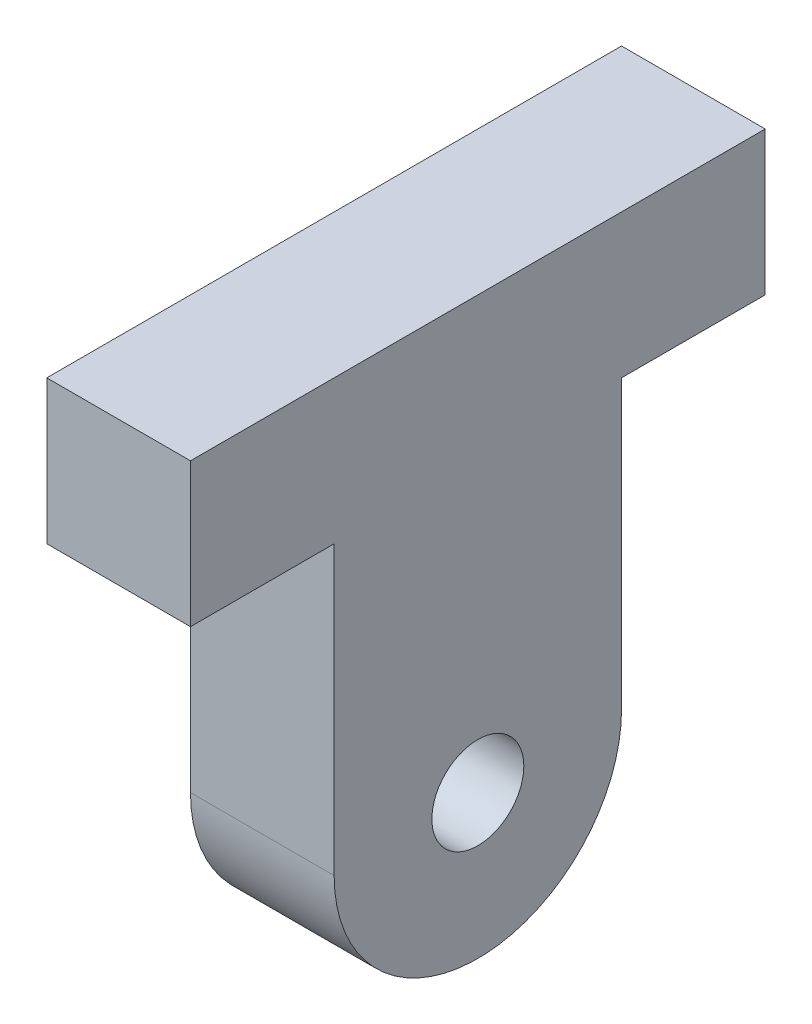
from build123d import *

# Parameters (mm, degrees)
SKETCH_3_R      = 1.6
EXTRUDE_1_DEPTH = 5


with BuildPart() as part:
    # 草图3 → 凸台-拉伸1 (new body)
    with BuildSketch(Plane(origin=(0, 0, 0), x_dir=(0, 0, -1), z_dir=(1, 0, 0))):
        with BuildLine():
            Line((0, 0), (20, 0))
            Line((20, 0), (20, -5))
            Line((20, -5), (15, -5))
            Line((15, -5), (15, -15))
            ThreePointArc((15, -15), (10, -20), (5, -15))
            Line((5, -15), (5, -5))
            Line((5, -5), (0, -5))
            Line((0, -5), (0, 0))
        make_face()
        with Locations((10, -15)):
            Circle(SKETCH_3_R, mode=Mode.SUBTRACT)
    extrude(amount=EXTRUDE_1_DEPTH)


solid = part.part
